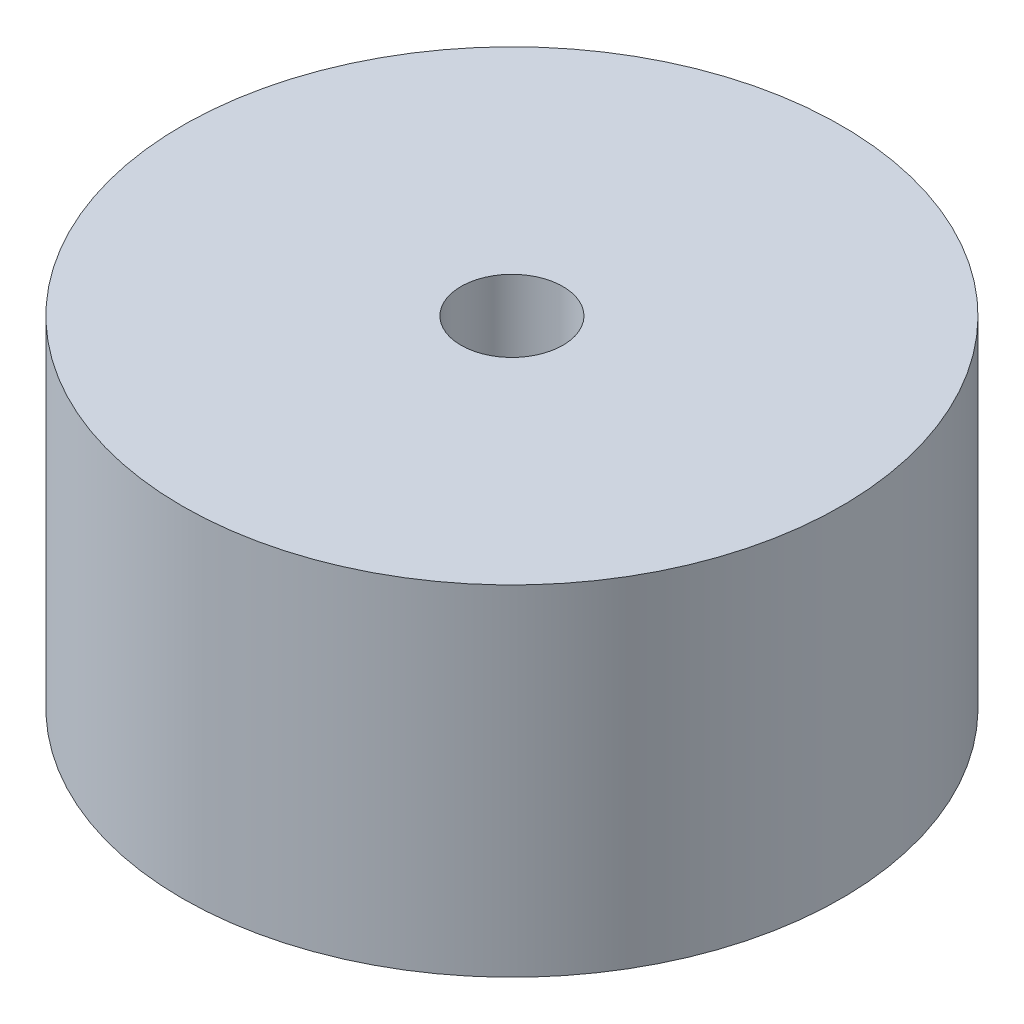
from build123d import *

# Parameters (mm, degrees)
SKETCH1_R           = 48.5
BOSS_EXTRUDE1_DEPTH = 50
SKETCH2_R           = 7.5
CUT_EXTRUDE1_DEPTH  = 30


with BuildPart() as part:
    # Sketch1 → Boss-Extrude1 (new body)
    with BuildSketch(Plane(origin=(0, 0, 0), x_dir=(1, 0, 0), z_dir=(0, 1, 0))):
        with Locations(Location((0, 0, 0), (0, 0, 270))):
            Circle(SKETCH1_R)
    extrude(amount=BOSS_EXTRUDE1_DEPTH)

    # Sketch2 → Cut-Extrude1 (cut)
    with BuildSketch(Plane(origin=(0, 50, 0), x_dir=(1, 0, 0), z_dir=(0, 1, 0))):
        with Locations(Location((0, 0, 0), (0, 0, 270))):
            Circle(SKETCH2_R)
    extrude(amount=-CUT_EXTRUDE1_DEPTH, mode=Mode.SUBTRACT)


solid = part.part
